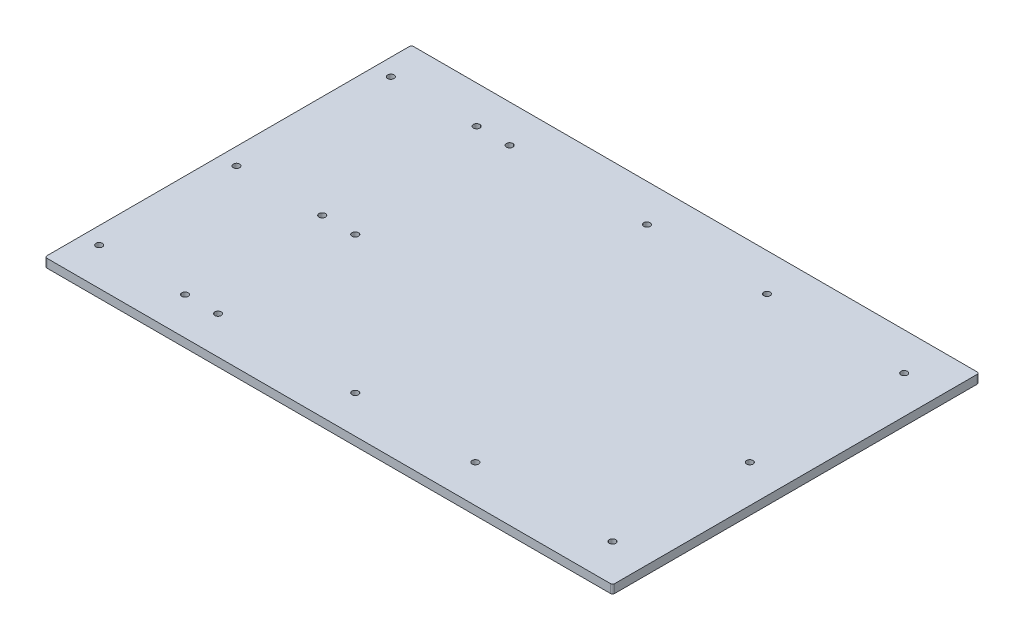
from build123d import *

# Parameters (mm, degrees)
SKETCH1_R           = 4.7625
BOSS_EXTRUDE1_DEPTH = 12.7


with BuildPart() as part:
    # Sketch1 → Boss-Extrude1 (new body)
    with BuildSketch(Plane(origin=(0, 0, 0), x_dir=(1, 0, 0), z_dir=(0, 1, 0))):
        with BuildLine():
            Line((-420.37, 268.2875), (-420.37, -268.2875))
            ThreePointArc((-420.37, -268.2875), (-419.44006403, -270.53256403), (-417.195, -271.4625))
            Line((-417.195, -271.4625), (417.195, -271.4625))
            ThreePointArc((417.195, -271.4625), (419.44006403, -270.53256403), (420.37, -268.2875))
            Line((420.37, -268.2875), (420.37, 268.2875))
            ThreePointArc((420.37, 268.2875), (419.44006403, 270.53256403), (417.195, 271.4625))
            Line((417.195, 271.4625), (-417.195, 271.4625))
            ThreePointArc((-417.195, 271.4625), (-419.44006403, 270.53256403), (-420.37, 268.2875))
        make_face()
        with Locations(Location((-16.1925, -215.9, 0), (0, 0, 270))):
            Circle(SKETCH1_R, mode=Mode.SUBTRACT)
        with Locations(Location((161.6075, -215.9, 0), (0, 0, 270))):
            Circle(SKETCH1_R, mode=Mode.SUBTRACT)
        with Locations(Location((161.6075, 215.9, 0), (0, 0, 270))):
            Circle(SKETCH1_R, mode=Mode.SUBTRACT)
        with Locations(Location((-16.1925, 215.9, 0), (0, 0, 270))):
            Circle(SKETCH1_R, mode=Mode.SUBTRACT)
        with Locations(Location((-268.2875, -215.9, 0), (0, 0, 270))):
            Circle(SKETCH1_R, mode=Mode.SUBTRACT)
        with Locations(Location((-395.2875, -215.9, 0), (0, 0, 270))):
            Circle(SKETCH1_R, mode=Mode.SUBTRACT)
        with Locations(Location((-268.2875, 215.9, 0), (0, 0, 270))):
            Circle(SKETCH1_R, mode=Mode.SUBTRACT)
        with Locations(Location((-395.2875, 215.9, 0), (0, 0, 270))):
            Circle(SKETCH1_R, mode=Mode.SUBTRACT)
        with Locations(Location((364.8075, -215.9, 0), (0, 0, 270))):
            Circle(SKETCH1_R, mode=Mode.SUBTRACT)
        with Locations(Location((-219.3925, -215.9, 0), (0, 0, 270))):
            Circle(SKETCH1_R, mode=Mode.SUBTRACT)
        with Locations(Location((364.8075, 215.9, 0), (0, 0, 270))):
            Circle(SKETCH1_R, mode=Mode.SUBTRACT)
        with Locations(Location((-219.3925, 215.9, 0), (0, 0, 270))):
            Circle(SKETCH1_R, mode=Mode.SUBTRACT)
        with Locations(Location((-219.3925, -12.7, 0), (0, 0, 90))):
            Circle(SKETCH1_R, mode=Mode.SUBTRACT)
        with Locations(Location((364.8075, -12.7, 0), (0, 0, 90))):
            Circle(SKETCH1_R, mode=Mode.SUBTRACT)
        with Locations(Location((-395.2875, -12.7, 0), (0, 0, 90))):
            Circle(SKETCH1_R, mode=Mode.SUBTRACT)
        with Locations(Location((-268.2875, -12.7, 0), (0, 0, 90))):
            Circle(SKETCH1_R, mode=Mode.SUBTRACT)
    extrude(amount=BOSS_EXTRUDE1_DEPTH)


solid = part.part
